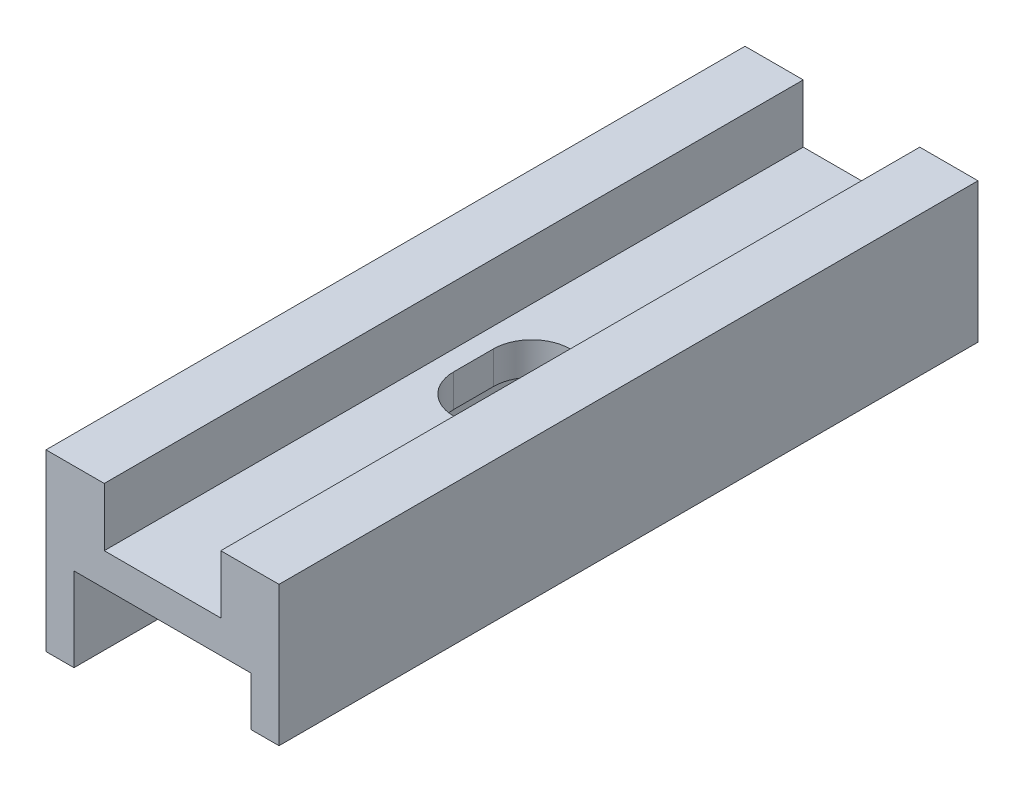
from build123d import *

# Parameters (mm, degrees)
BOSS_EXTRUDE1_DEPTH = 38.1
CUT_EXTRUDE1_REACH  = 44.121


with BuildPart() as part:
    # Sketch1 → Boss-Extrude1 (new, symmetric)
    with BuildSketch(Plane.XY):
        Polygon((-12.7, 7.62), (-6.35, 7.62), (-6.35, 1.27), (6.35, 1.27), (6.35, 7.62), (12.7, 7.62), (12.7, -7.62), (9.652, -7.62), (9.652, -2.286), (-9.652, -2.286), (-9.652, -11.43), (-12.7, -11.43), align=None)
    extrude(amount=BOSS_EXTRUDE1_DEPTH, both=True)

    # Sketch2 → Cut-Extrude1 (cut, up to next)
    with BuildSketch(Plane(origin=(0, 1.27, 0), x_dir=(1, 0, 0), z_dir=(0, 1, 0)), mode=Mode.PRIVATE) as cut_extrude1_sk1:
        with BuildLine():
            Line((4.191, 2.159), (4.191, -2.159))
            ThreePointArc((4.191, -2.159), (0, -6.35), (-4.191, -2.159))
            Line((-4.191, -2.159), (-4.191, 2.159))
            ThreePointArc((-4.191, 2.159), (0, 6.35), (4.191, 2.159))
        make_face()
    cut_extrude1_tool1 = extrude(cut_extrude1_sk1.sketch, amount=-CUT_EXTRUDE1_REACH, mode=Mode.PRIVATE) & part.part
    add(cut_extrude1_tool1.solids().sort_by_distance((0, 1.27, 0))[0], mode=Mode.SUBTRACT)


solid = part.part
